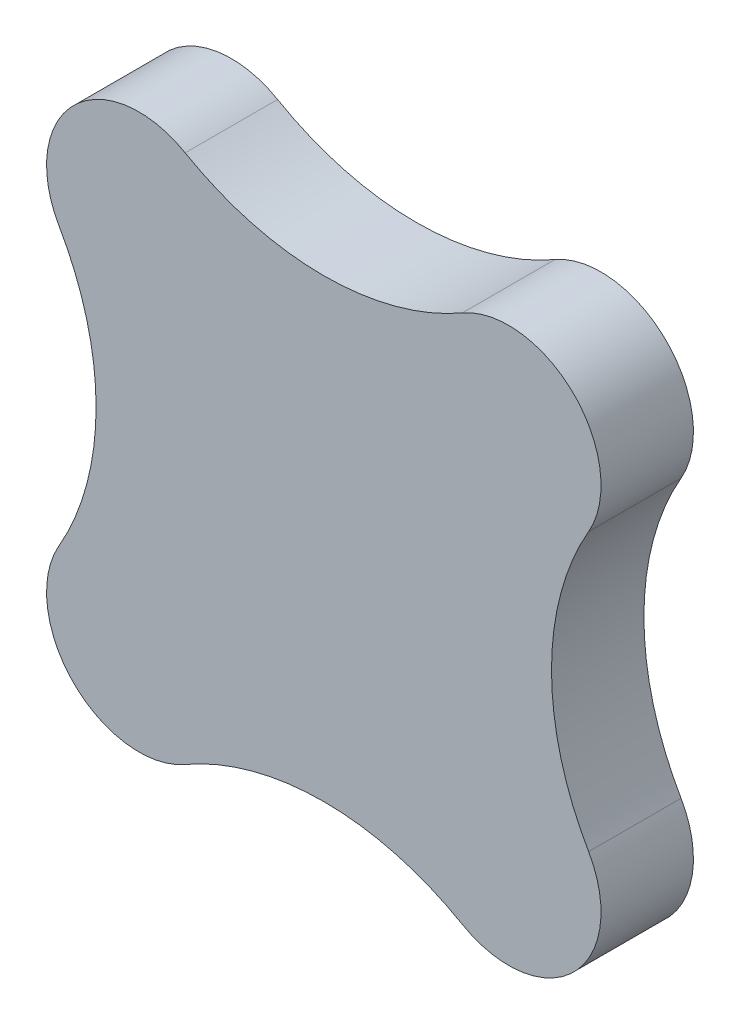
from build123d import *

# Parameters (mm, degrees)
EXTRUDE_1_DEPTH = 12.7


with BuildPart() as part:
    # 스케치1 → 보스-돌출1 (new body)
    with BuildSketch(Plane.XY):
        with BuildLine():
            ThreePointArc((-19.05, 36.398522628), (-34.380256121, 34.380256121), (-36.398522628, 19.05))
            ThreePointArc((-36.398522628, 19.05), (-31.294090512, 0), (-36.398522628, -19.05))
            ThreePointArc((-36.398522628, -19.05), (-34.380256121, -34.380256121), (-19.05, -36.398522628))
            ThreePointArc((-19.05, -36.398522628), (0, -31.294090512), (19.05, -36.398522628))
            ThreePointArc((19.05, -36.398522628), (34.380256121, -34.380256121), (36.398522628, -19.05))
            ThreePointArc((36.398522628, -19.05), (31.294090512, 0), (36.398522628, 19.05))
            ThreePointArc((36.398522628, 19.05), (34.380256121, 34.380256121), (19.05, 36.398522628))
            ThreePointArc((19.05, 36.398522628), (0, 31.294090512), (-19.05, 36.398522628))
        make_face()
    extrude(amount=-EXTRUDE_1_DEPTH)


solid = part.part
